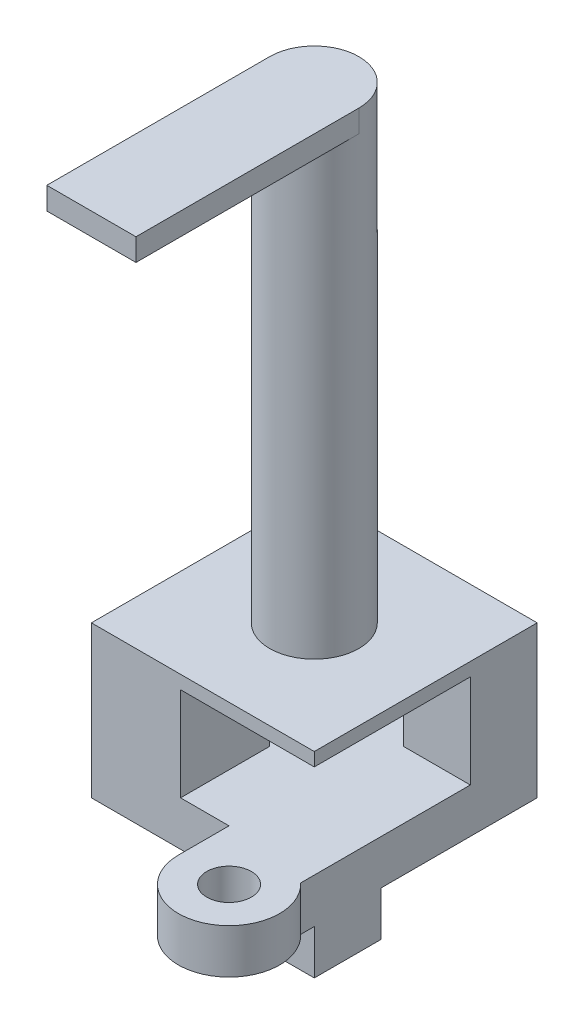
from build123d import *

# Parameters (mm, degrees)
SKETCH1_R           = 5
BOSS_EXTRUDE1_DEPTH = 10
BOSS_EXTRUDE2_DEPTH = 10
SKETCH3_W           = 20
SKETCH3_H           = 20
SKETCH3_W_2         = 15
SKETCH3_H_2         = 15
BOSS_EXTRUDE3_DEPTH = 21
SKETCH4_W           = 50
SKETCH4_H           = 50
BOSS_EXTRUDE4_DEPTH = 3
SKETCH5_R           = 10
BOSS_EXTRUDE5_DEPTH = 100
BOSS_EXTRUDE6_DEPTH = 5


with BuildPart() as part:
    # Sketch1 → Boss-Extrude1 (new body)
    with BuildSketch(Plane(origin=(0, 0, 0), x_dir=(1, 0, 0), z_dir=(0, 1, 0))):
        with BuildLine():
            Line((0, 0), (30.876052193, 0))
            Line((30.876052193, 0), (30.876052193, -11.362717468))
            ThreePointArc((30.876052193, -11.362717468), (46.762190972, -21.786248919), (50, -3.063642105))
            Line((50, -3.063642105), (50, 0))
            Line((50, 0), (50, 50))
            Line((50, 50), (0, 50))
            Line((0, 50), (0, 0))
        make_face()
        with Locations(Location((42.238769661, -11.362717468, 0), (0, 0, 270))):
            Circle(SKETCH1_R, mode=Mode.SUBTRACT)
        with BuildLine():
            Line((9.874654059, 47.191553979), (24.296746366, 33.290272916))
            ThreePointArc((24.296746366, 33.290272916), (24.424993645, 26.799159409), (17.934255558, 26.653142217))
            Line((17.934255558, 26.653142217), (3.436266044, 40.475249935))
            ThreePointArc((3.436266044, 40.475249935), (3.288101967, 47.061421086), (9.874654059, 47.191553979))
        make_face(mode=Mode.SUBTRACT)
    extrude(amount=BOSS_EXTRUDE1_DEPTH)

    # Sketch2 → Boss-Extrude2 (add)
    with BuildSketch(Plane.XZ):
        Polygon((45, -5), (35, -5), (35, 0), (50, 0), (50, -15), (45, -15), align=None)
    extrude(amount=BOSS_EXTRUDE2_DEPTH)

    # Sketch3 → Boss-Extrude3 (add)
    with BuildSketch(Plane(origin=(0, 10, 0), x_dir=(1, 0, 0), z_dir=(0, 1, 0))):
        with Locations((10, 10)):
            Rectangle(SKETCH3_W, SKETCH3_H)
        with Locations((42.5, 42.5)):
            Rectangle(SKETCH3_W_2, SKETCH3_H_2)
    extrude(amount=BOSS_EXTRUDE3_DEPTH)

    # Sketch4 → Boss-Extrude4 (add)
    with BuildSketch(Plane(origin=(0, 31, 0), x_dir=(1, 0, 0), z_dir=(0, 1, 0))):
        with Locations((25, 25)):
            Rectangle(SKETCH4_W, SKETCH4_H)
    extrude(amount=BOSS_EXTRUDE4_DEPTH)

    # Sketch5 → Boss-Extrude5 (add)
    with BuildSketch(Plane(origin=(0, 34, 0), x_dir=(1, 0, 0), z_dir=(0, 1, 0))):
        with Locations(Location((25, 25, 0), (0, 0, 270))):
            Circle(SKETCH5_R)
    extrude(amount=BOSS_EXTRUDE5_DEPTH)

    # Sketch6 → Boss-Extrude6 (add)
    with BuildSketch(Plane(origin=(0, 134, 0), x_dir=(1, 0, 0), z_dir=(0, 1, 0))):
        with BuildLine():
            Line((35, 25), (35, -25))
            Line((35, -25), (15, -25))
            Line((15, -25), (15, 25))
            ThreePointArc((15, 25), (25, 35), (35, 25))
        make_face()
    extrude(amount=BOSS_EXTRUDE6_DEPTH)


solid = part.part
